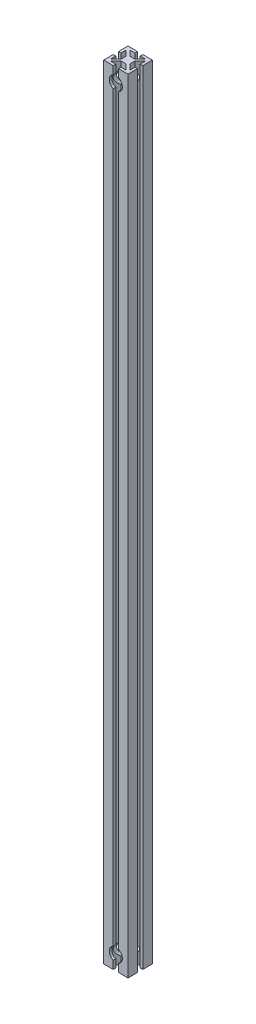
from build123d import *

# Parameters (mm, degrees)
BOSS_EXTRUDE1_DEPTH     = 1223.9625
SKETCH3_R               = 10.287
CUT_EXTRUDE1_DEPTH      = 16.51
MIRROR2_COPY_1_SKETCH_R = 10.287
MIRROR2_COPY_1_DEPTH    = 16.51


with BuildPart() as part:
    # Sketch2 → Boss-Extrude1 (new body)
    with BuildSketch(Plane(origin=(0.594697292, 0, 0.594697292), x_dir=(1, 0, 0), z_dir=(0, 1, 0))):
        Polygon((-19.644697292, 19.644697292), (-4.658697292, 19.644697292), (-4.658697292, 15.580697292), (-12.707015333, 15.580697292), (-4.477415333, 7.351097292), (3.288020749, 7.351097292), (11.517620749, 15.580697292), (3.469302708, 15.580697292), (3.469302708, 19.644697292), (18.455302708, 19.644697292), (18.455302708, 4.658697292), (14.391302708, 4.658697292), (14.391302708, 12.707015333), (6.161702708, 4.477415333), (6.161702708, -3.288020749), (14.391302708, -11.517620749), (14.391302708, -3.469302708), (18.455302708, -3.469302708), (18.455302708, -18.455302708), (3.469302708, -18.455302708), (3.469302708, -14.391302708), (11.517620749, -14.391302708), (3.288020749, -6.161702708), (-4.477415333, -6.161702708), (-12.707015333, -14.391302708), (-4.658697292, -14.391302708), (-4.658697292, -18.455302708), (-19.644697292, -18.455302708), (-19.644697292, -3.469302708), (-15.580697292, -3.469302708), (-15.580697292, -11.517620749), (-7.351097292, -3.288020749), (-7.351097292, 4.477415333), (-15.580697292, 12.707015333), (-15.580697292, 4.658697292), (-19.644697292, 4.658697292), align=None)
    extrude(amount=BOSS_EXTRUDE1_DEPTH)

    # Sketch3 → Cut-Extrude1 (cut)
    with BuildSketch(Plane.XY.offset(19.05)):
        with Locations(Location((0, 21.844, 0), (0, 0, 48.944473627))):
            Circle(SKETCH3_R)
    cut_extrude1 = extrude(amount=-CUT_EXTRUDE1_DEPTH, mode=Mode.SUBTRACT)

    # Mirror1: Cut-Extrude1 across plane
    add(cut_extrude1.mirror(Plane.XY), mode=Mode.SUBTRACT)

    # Mirror2: Cut-Extrude1 across plane
    add(cut_extrude1.mirror(Plane.ZX.offset(611.98125)), mode=Mode.SUBTRACT)

    # Mirror2 copy 1 sketch → Mirror2 copy 1 (cut)
    with BuildSketch(Plane(origin=(0, 1223.9625, -19.05), x_dir=(1, 0, 0), z_dir=(0, 0, -1))):
        with Locations(Location((0, 21.844, 0), (0, 0, 48.944473627))):
            Circle(MIRROR2_COPY_1_SKETCH_R)
    extrude(amount=-MIRROR2_COPY_1_DEPTH, mode=Mode.SUBTRACT)


solid = part.part
